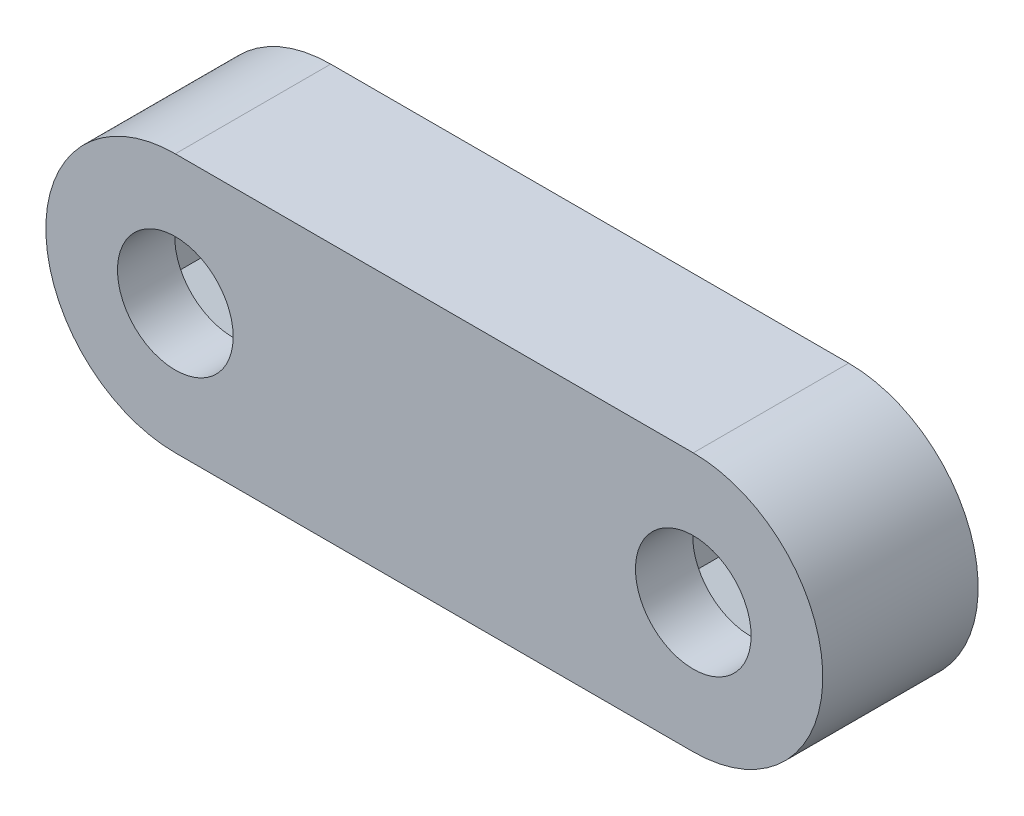
from build123d import *

# Parameters (mm, degrees)
BOSS_EXTRUDE1_DEPTH = 18
SKETCH2_R           = 10
CUT_EXTRUDE1_DEPTH  = 5.6
SKETCH3_R           = 8.371578903
SKETCH3_R_2         = 6.7
BOSS_EXTRUDE2_DEPTH = 6.63


with BuildPart() as part:
    # Sketch1 → Boss-Extrude1 (new body)
    with BuildSketch(Plane.XY):
        with BuildLine():
            Line((15, 0), (75, 0))
            ThreePointArc((75, 0), (90, 15), (75, 30))
            Line((75, 30), (15, 30))
            ThreePointArc((15, 30), (0, 15), (15, 0))
        make_face()
        Polygon((15, 23.371578903), (7.75, 19.185789452), (7.75, 10.814210548), (15, 6.628421097), (22.25, 10.814210548), (22.25, 19.185789452), align=None, mode=Mode.SUBTRACT)
        Polygon((75, 23.371578903), (67.75, 19.185789452), (67.75, 10.814210548), (75, 6.628421097), (82.25, 10.814210548), (82.25, 19.185789452), align=None, mode=Mode.SUBTRACT)
    extrude(amount=BOSS_EXTRUDE1_DEPTH)

    # Sketch2 → Cut-Extrude1 (cut)
    with BuildSketch(Plane(origin=(0, 0, 0), x_dir=(-1, 0, 0), z_dir=(0, 0, -1))):
        with Locations((-75, 15)):
            Circle(SKETCH2_R)
        with Locations((-15, 15)):
            Circle(SKETCH2_R)
    extrude(amount=-CUT_EXTRUDE1_DEPTH, mode=Mode.SUBTRACT)

    # Sketch3 → Boss-Extrude2 (add)
    # profile 1 of 2: a face of its own
    with BuildSketch(Plane.XY.offset(18)):
        with Locations((75, 15)):
            Circle(SKETCH3_R)
        with Locations((75, 15)):
            Circle(SKETCH3_R_2, mode=Mode.SUBTRACT)
    # profile 2 of 2: a face of its own
    with BuildSketch(Plane.XY.offset(18)):
        with Locations((15, 15)):
            Circle(SKETCH3_R)
        with Locations((15, 15)):
            Circle(SKETCH3_R_2, mode=Mode.SUBTRACT)
    extrude(amount=-BOSS_EXTRUDE2_DEPTH)


solid = part.part
